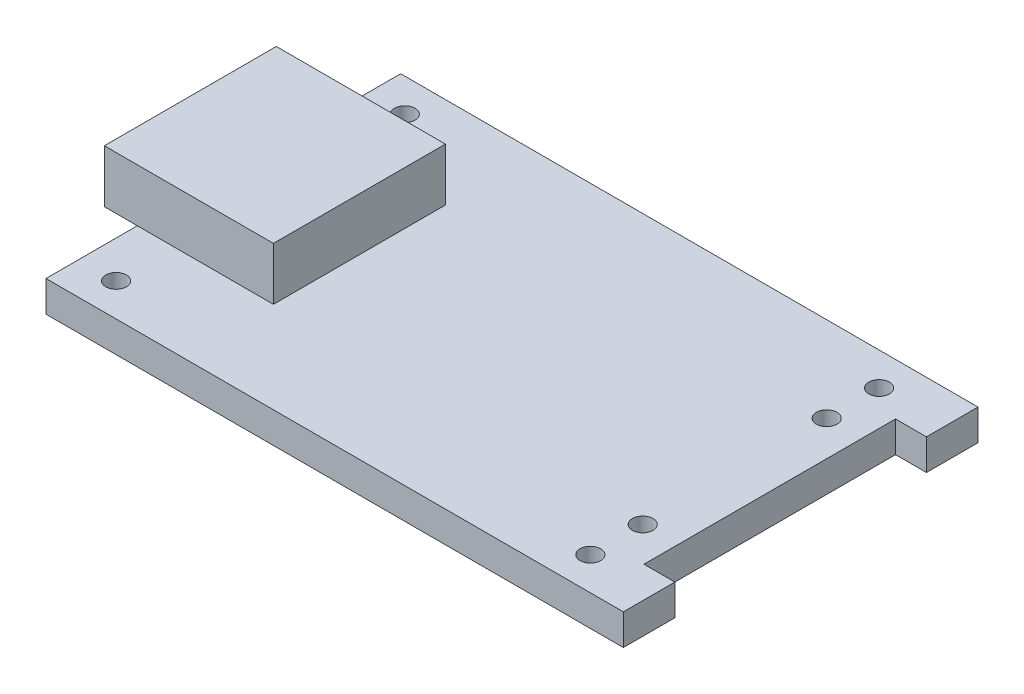
from build123d import *

# Parameters (mm, degrees)
SKETCH_1_W          = 28
SKETCH_1_H          = 17.2
EXTRUDE_1_DEPTH     = 1.5
SKETCH_2_W          = 8.2
SKETCH_2_H          = 8.34
EXTRUDE_2_DEPTH     = 2.56
SKETCH_3_R          = 0.5
CUT_EXTRUDE_1_DEPTH = 10
SKETCH_4_W          = 1.5
SKETCH_4_H          = 12.2
CUT_EXTRUDE_2_DEPTH = 10


with BuildPart() as part:
    # Эскиз1 → Бобышка-Вытянуть1 (new body)
    with BuildSketch(Plane(origin=(0, 0, 0), x_dir=(1, 0, 0), z_dir=(0, 1, 0))):
        with Locations((14, -8.6)):
            Rectangle(SKETCH_1_W, SKETCH_1_H)
    extrude(amount=EXTRUDE_1_DEPTH)

    # Эскиз2 → Бобышка-Вытянуть2 (add)
    with BuildSketch(Plane(origin=(0, 1.5, 0), x_dir=(1, 0, 0), z_dir=(0, 1, 0))):
        with Locations((2.5, -8.6)):
            Rectangle(SKETCH_2_W, SKETCH_2_H)
    extrude(amount=EXTRUDE_2_DEPTH)

    # Эскиз3 → Вырез-Вытянуть1 (cut)
    with BuildSketch(Plane(origin=(0, 1.5, 0), x_dir=(1, 0, 0), z_dir=(0, 1, 0))):
        with Locations((1.8, -1.6)):
            Circle(SKETCH_3_R)
        with Locations((1.8, -15.6)):
            Circle(SKETCH_3_R)
        with Locations((24.8, -1.6)):
            Circle(SKETCH_3_R)
        with Locations((24.8, -4.14)):
            Circle(SKETCH_3_R)
        with Locations((24.8, -13.06)):
            Circle(SKETCH_3_R)
        with Locations((24.8, -15.6)):
            Circle(SKETCH_3_R)
    extrude(amount=-CUT_EXTRUDE_1_DEPTH, mode=Mode.SUBTRACT)

    # Эскиз4 → Вырез-Вытянуть2 (cut)
    with BuildSketch(Plane(origin=(0, 1.5, 0), x_dir=(1, 0, 0), z_dir=(0, 1, 0))):
        with Locations((27.25, -8.6)):
            Rectangle(SKETCH_4_W, SKETCH_4_H)
    extrude(amount=-CUT_EXTRUDE_2_DEPTH, mode=Mode.SUBTRACT)


solid = part.part
